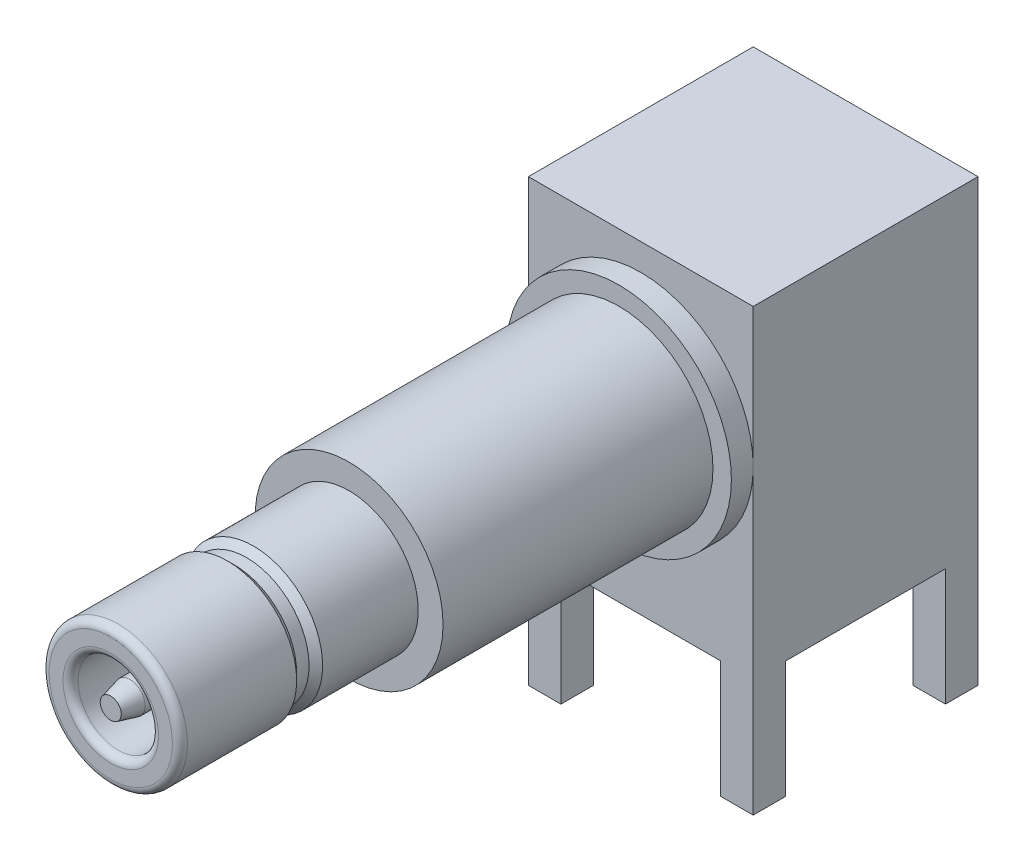
from build123d import *

# Parameters (mm, degrees)
SKETCH1_W          = 5.98
SKETCH1_H          = 5.98
EXTRUDE1_DEPTH     = 8.6
SKETCH3_W          = 0.865
SKETCH3_H          = 0.865
EXTRUDE3_DEPTH     = 3.12
SKETCH4_R          = 1.693605641
CUT_EXTRUDE1_DEPTH = 0.254
SKETCH5_R          = 0.4826
EXTRUDE4_DEPTH     = 3.374
SKETCH6_R          = 2.99
EXTRUDE5_DEPTH     = 0.58
ESQUISSE1_R        = 2.5
BOSS_EXTRU_1_DEPTH = 7.18
SKETCH7_R          = 1.84
EXTRUDE6_DEPTH     = 6.34
SKETCH9_R          = 1.07
CUT_EXTRUDE2_DEPTH = 5.658092827
SKETCH10_R         = 0.406972167
EXTRUDE7_DEPTH     = 5.658092827
CHAMFER1_SIZE      = 0.508
CHAMFER1_SIZE2     = 0.126658625
CONG_1_R           = 0.2


with BuildPart() as part:
    # Sketch1 → Extrude1 (new body)
    with BuildSketch(Plane(origin=(0, 0, 0), x_dir=(1, 0, 0), z_dir=(0, 1, 0))):
        Rectangle(SKETCH1_W, SKETCH1_H)
    extrude(amount=EXTRUDE1_DEPTH)

    # Sketch3 → Extrude3 (add)
    with BuildSketch(Plane.XZ):
        with Locations((2.5575, 2.5575)):
            Rectangle(SKETCH3_W, SKETCH3_H)
        with Locations((2.5575, -2.5575)):
            Rectangle(SKETCH3_W, SKETCH3_H)
        with Locations((-2.5575, -2.5575)):
            Rectangle(SKETCH3_W, SKETCH3_H)
        with Locations((-2.5575, 2.5575)):
            Rectangle(SKETCH3_W, SKETCH3_H)
    extrude(amount=EXTRUDE3_DEPTH)

    # Sketch4 → Cut-Extrude1 (cut)
    with BuildSketch(Plane.XZ):
        with Locations(Location((0, 0, 0), (0, 0, 270))):
            Circle(SKETCH4_R)
    extrude(amount=-CUT_EXTRUDE1_DEPTH, mode=Mode.SUBTRACT)

    # Sketch5 → Extrude4 (add)
    with BuildSketch(Plane.XZ.offset(-0.254)):
        with Locations(Location((0, 0, 0), (0, 0, 90))):
            Circle(SKETCH5_R)
    extrude(amount=EXTRUDE4_DEPTH)

    # Sketch6 → Extrude5 (add)
    with BuildSketch(Plane.XY.offset(2.99)):
        with Locations((0, 4.9)):
            Circle(SKETCH6_R)
    extrude(amount=EXTRUDE5_DEPTH)

    # Esquisse1 → Boss.-Extru.1 (add)
    with BuildSketch(Plane.XY.offset(3.57)):
        with Locations((0, 4.9)):
            Circle(ESQUISSE1_R)
    extrude(amount=BOSS_EXTRU_1_DEPTH)

    # Sketch7 → Extrude6 (add)
    with BuildSketch(Plane.XY.offset(10.75)):
        with Locations(Location((0, 4.9, 0), (0, 0, 180))):
            Circle(SKETCH7_R)
    extrude(amount=EXTRUDE6_DEPTH)

    # Esquisse2 → Enlèvement de matière-Révolution1 (revolve, cut)
    with BuildSketch(Plane(origin=(0, 4.9, 0), x_dir=(-1, 0, 0), z_dir=(0, 1, 0)), mode=Mode.PRIVATE) as enl_vement_de_mati_re_r_volution1_sk:
        Polygon((-2.367106781, 14.512106781), (-1.66, 13.805), (-1.66, 13.475), (-2.367106781, 12.767893219), align=None)
    revolve(enl_vement_de_mati_re_r_volution1_sk.sketch.rotate(Axis((0, 4.9, 17.09), (0, 0, -1)), 180), axis=Axis((0, 4.9, 17.09), (0, 0, -1)), mode=Mode.SUBTRACT)

    # Sketch9 → Cut-Extrude2 (cut)
    with BuildSketch(Plane.XY.offset(17.09)):
        with Locations((0, 4.9)):
            Circle(SKETCH9_R)
    extrude(amount=-CUT_EXTRUDE2_DEPTH, mode=Mode.SUBTRACT)

    # Sketch10 → Extrude7 (add)
    with BuildSketch(Plane.XY.offset(11.431907173)):
        with Locations((0, 4.9)):
            Circle(SKETCH10_R)
    extrude(amount=EXTRUDE7_DEPTH)

    # Chamfer1
    chamfer1_edges = [part.edges().sort_by_distance(p)[0] for p in [
        (-0.406972167, 4.9, 17.09),
    ]]
    chamfer1_side = [part.faces().sort_by_distance(p)[0] for p in [
        (-0.406972167, 4.9, 14.260953587),
    ]]
    chamfer(chamfer1_edges, length=CHAMFER1_SIZE, length2=CHAMFER1_SIZE2, reference=chamfer1_side[0])

    # Congé1
    cong_1_edges = [part.edges().sort_by_distance(p)[0] for p in [
        (1.84, 4.9, 17.09),
        (-1.07, 4.9, 17.09),
    ]]
    fillet(cong_1_edges, radius=CONG_1_R)


solid = part.part
